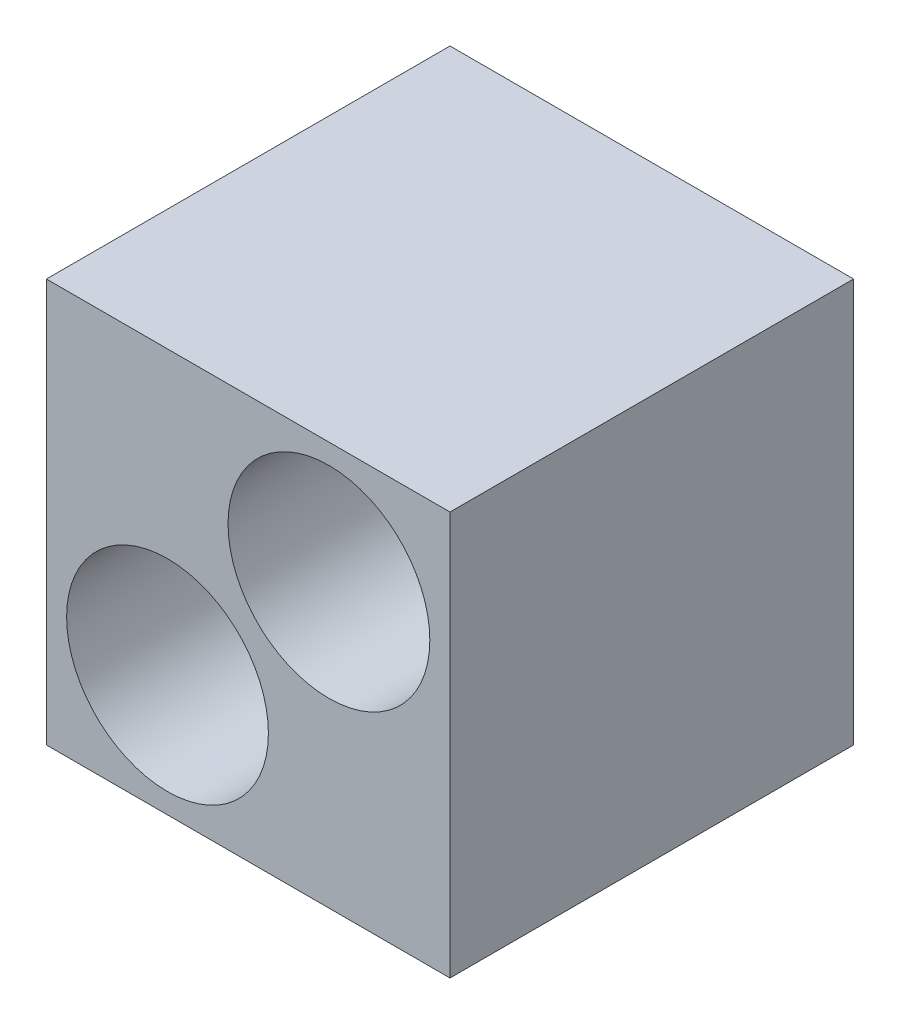
from build123d import *

# Parameters (mm, degrees)
SKETCH1_W           = 10
SKETCH1_H           = 10
BOSS_EXTRUDE1_DEPTH = 10
SKETCH2_R           = 2.5
CUT_EXTRUDE1_DEPTH  = 18.320508076


with BuildPart() as part:
    # Sketch1 → Boss-Extrude1 (new body)
    with BuildSketch(Plane.XY):
        with Locations((5, 5)):
            Rectangle(SKETCH1_W, SKETCH1_H)
    extrude(amount=BOSS_EXTRUDE1_DEPTH)

    # Sketch2 → Cut-Extrude1 (cut, through all)
    with BuildSketch(Plane.XY):
        with Locations((3, 3)):
            Circle(SKETCH2_R)
        with Locations((7, 7)):
            Circle(SKETCH2_R)
    extrude(amount=CUT_EXTRUDE1_DEPTH, mode=Mode.SUBTRACT)


solid = part.part
